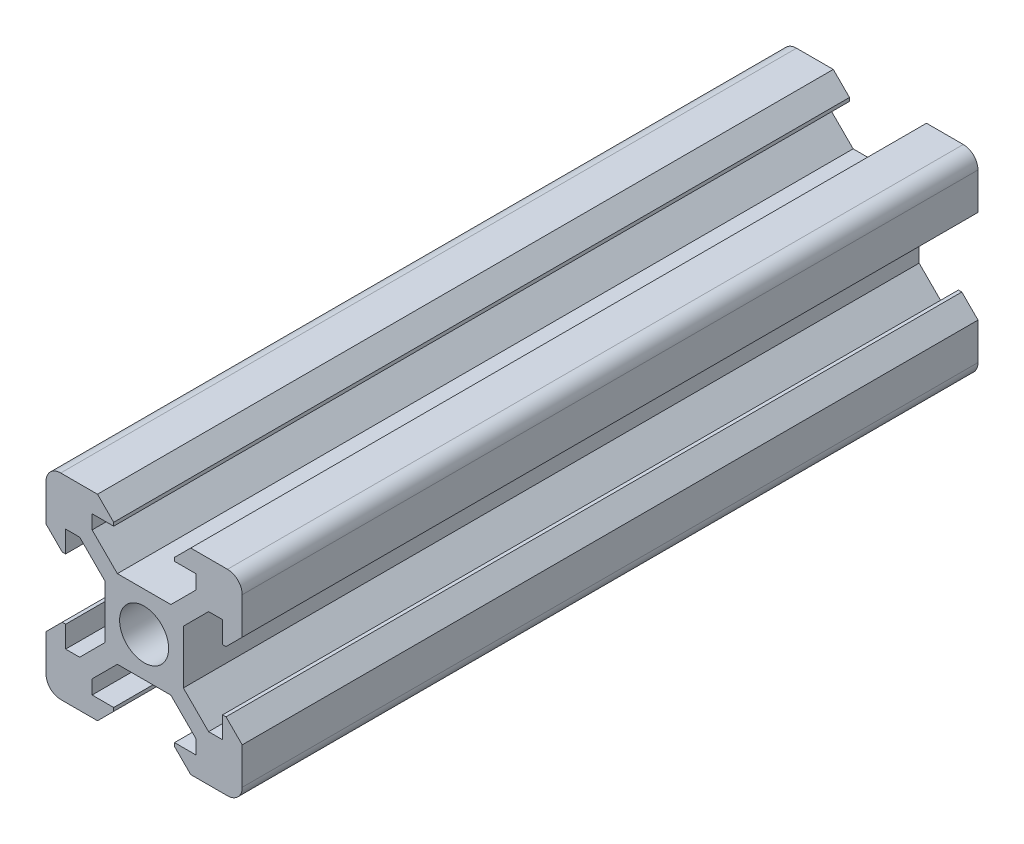
from build123d import *

# Parameters (mm, degrees)
SKETCH2_R           = 2.5
BOSS_EXTRUDE1_DEPTH = 75


with BuildPart() as part:
    # Sketch2 → Boss-Extrude1 (new body)
    with BuildSketch(Plane.XY):
        with BuildLine():
            Line((-4, -2.727207794), (-4, 2.727207794))
            Line((-4, 2.727207794), (-6.572792206, 5.3))
            Line((-6.572792206, 5.3), (-8, 5.3))
            Line((-8, 5.3), (-8, 3.1))
            Line((-8, 3.1), (-8.35, 3.1))
            Line((-8.35, 3.1), (-10, 4.75))
            Line((-10, 4.75), (-10, 8.5))
            ThreePointArc((-10, 8.5), (-9.560660172, 9.560660172), (-8.5, 10))
            Line((-8.5, 10), (-4.75, 10))
            Line((-4.75, 10), (-3.1, 8.35))
            Line((-3.1, 8.35), (-3.1, 8))
            Line((-3.1, 8), (-5.3, 8))
            Line((-5.3, 8), (-5.3, 6.572792206))
            Line((-5.3, 6.572792206), (-2.727207794, 4))
            Line((-2.727207794, 4), (2.727207794, 4))
            Line((2.727207794, 4), (5.3, 6.572792206))
            Line((5.3, 6.572792206), (5.3, 8))
            Line((5.3, 8), (3.1, 8))
            Line((3.1, 8), (3.1, 8.35))
            Line((3.1, 8.35), (4.75, 10))
            Line((4.75, 10), (8.5, 10))
            ThreePointArc((8.5, 10), (9.560660172, 9.560660172), (10, 8.5))
            Line((10, 8.5), (10, 4.75))
            Line((10, 4.75), (8.35, 3.1))
            Line((8.35, 3.1), (8, 3.1))
            Line((8, 3.1), (8, 5.3))
            Line((8, 5.3), (6.572792206, 5.3))
            Line((6.572792206, 5.3), (4, 2.727207794))
            Line((4, 2.727207794), (4, -2.727207794))
            Line((4, -2.727207794), (6.572792206, -5.3))
            Line((6.572792206, -5.3), (8, -5.3))
            Line((8, -5.3), (8, -3.1))
            Line((8, -3.1), (8.35, -3.1))
            Line((8.35, -3.1), (10, -4.75))
            Line((10, -4.75), (10, -8.5))
            ThreePointArc((10, -8.5), (9.560660172, -9.560660172), (8.5, -10))
            Line((8.5, -10), (4.75, -10))
            Line((4.75, -10), (3.1, -8.35))
            Line((3.1, -8.35), (3.1, -8))
            Line((3.1, -8), (5.3, -8))
            Line((5.3, -8), (5.3, -6.572792206))
            Line((5.3, -6.572792206), (2.727207794, -4))
            Line((2.727207794, -4), (-2.727207794, -4))
            Line((-2.727207794, -4), (-5.3, -6.572792206))
            Line((-5.3, -6.572792206), (-5.3, -8))
            Line((-5.3, -8), (-3.1, -8))
            Line((-3.1, -8), (-3.1, -8.35))
            Line((-3.1, -8.35), (-4.75, -10))
            Line((-4.75, -10), (-8.5, -10))
            ThreePointArc((-8.5, -10), (-9.560660172, -9.560660172), (-10, -8.5))
            Line((-10, -8.5), (-10, -4.75))
            Line((-10, -4.75), (-8.35, -3.1))
            Line((-8.35, -3.1), (-8, -3.1))
            Line((-8, -3.1), (-8, -5.3))
            Line((-8, -5.3), (-6.572792206, -5.3))
            Line((-6.572792206, -5.3), (-4, -2.727207794))
        make_face()
        Circle(SKETCH2_R, mode=Mode.SUBTRACT)
    extrude(amount=BOSS_EXTRUDE1_DEPTH)


solid = part.part
